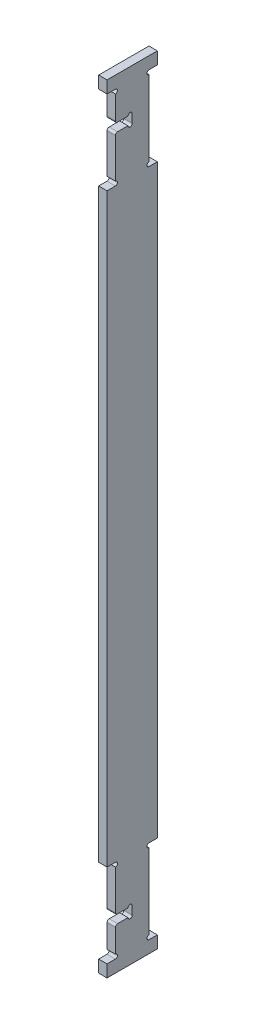
from build123d import *

# Parameters (mm, degrees)
BOSS_EXTRUDE1_DEPTH = 2


with BuildPart() as part:
    # Sketch2 → Boss-Extrude1 (new body)
    with BuildSketch(Plane(origin=(0, 0, 0), x_dir=(0, 0, -1), z_dir=(1, 0, 0))):
        with BuildLine():
            Line((-6, 0), (6, 0))
            Line((6, 0), (6, 69.865))
            Line((6, 69.865), (4, 69.865))
            ThreePointArc((4, 69.865), (3.5, 70.365), (4, 70.865))
            Line((4, 70.865), (4, 88.865))
            ThreePointArc((4, 88.865), (3.5, 89.365), (4, 89.865))
            Line((4, 89.865), (6, 89.865))
            Line((6, 89.865), (6, 92.781745931))
            Line((6, 92.781745931), (-6, 92.781745931))
            Line((-6, 92.781745931), (-6, 89.865))
            Line((-6, 89.865), (-4, 89.865))
            ThreePointArc((-4, 89.865), (-3.5, 89.365), (-4, 88.865))
            Line((-4, 88.865), (-4, 83.299671709))
            ThreePointArc((-4, 83.299671709), (-3.853553391, 82.946118318), (-3.5, 82.799671709))
            Line((-3.5, 82.799671709), (-1, 82.799671709))
            ThreePointArc((-1, 82.799671709), (-0.5, 83.299671709), (0, 82.799671709))
            Line((0, 82.799671709), (0, 80.799671709))
            ThreePointArc((0, 80.799671709), (-0.5, 80.299671709), (-1, 80.799671709))
            Line((-1, 80.799671709), (-3.5, 80.799671709))
            ThreePointArc((-3.5, 80.799671709), (-3.853553391, 80.653225099), (-4, 80.299671709))
            Line((-4, 80.299671709), (-4, 70.865))
            ThreePointArc((-4, 70.865), (-3.5, 70.365), (-4, 69.865))
            Line((-4, 69.865), (-6, 69.865))
            Line((-6, 69.865), (-6, 0))
        make_face()
    boss_extrude1 = extrude(amount=BOSS_EXTRUDE1_DEPTH)

    # Mirror1: Boss-Extrude1 across plane
    add(boss_extrude1.mirror(Plane.ZX))


solid = part.part
